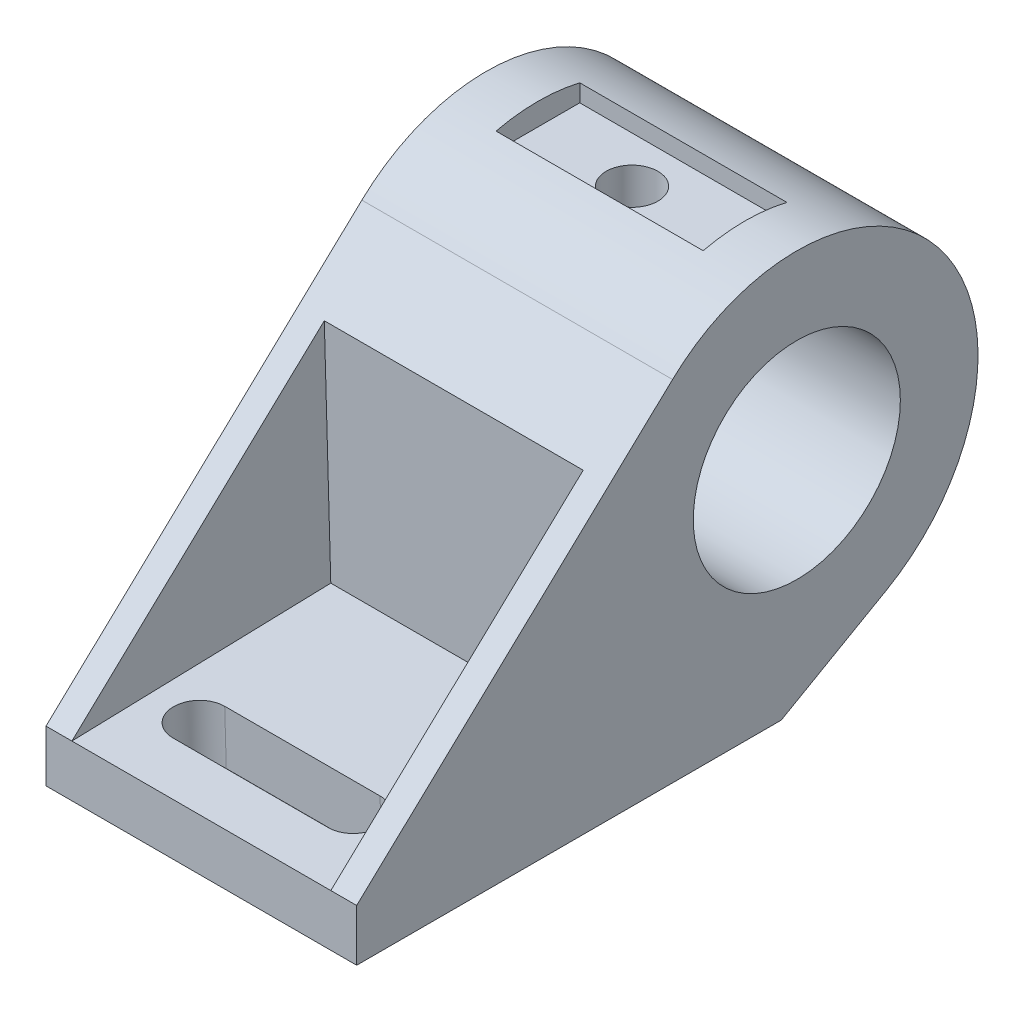
from build123d import *

# Parameters (mm, degrees)
SKETCH2_R           = 20
BOSS_EXTRUDE1_DEPTH = 60
CUT_EXTRUDE2_DEPTH  = 50
CUT_EXTRUDE3_DEPTH  = 50
SKETCH12_W          = 16.164310213
SKETCH12_H          = 9.181328202
CUT_EXTRUDE5_DEPTH  = 40
SKETCH13_R          = 5
CUT_EXTRUDE6_DEPTH  = 40


with BuildPart() as part:
    # Sketch2 → Boss-Extrude1 (new body)
    with BuildSketch(Plane(origin=(0, 0, 0), x_dir=(0, 0, -1), z_dir=(1, 0, 0))):
        with BuildLine():
            Line((-79.56687109, 0), (-79.56687109, 10))
            Line((-79.56687109, 10), (-18.568740921, 67.473716741))
            ThreePointArc((-18.568740921, 67.473716741), (33.570555999, 62.815503761), (22.769179524, 11.595044004))
            Line((22.769179524, 11.595044004), (2.43312891, 0))
            Line((2.43312891, 0), (-79.56687109, 0))
        make_face()
        with Locations((5.43312891, 42)):
            Circle(SKETCH2_R, mode=Mode.SUBTRACT)
    extrude(amount=-BOSS_EXTRUDE1_DEPTH)


with BuildPart() as part_1:
    # Body-Move/Copy1: moved
    add(part.part.moved(Location((5, 0, 0))))

    # Sketch4 → Cut-Extrude2 (cut)
    with BuildSketch(Plane(origin=(0, 0, 0), x_dir=(0, 0, -1), z_dir=(1, 0, 0))):
        Polygon((-79.56687109, 10), (-29.56687109, 11.408616082), (-30.821121194, 55.929267243), align=None)
    extrude(amount=-CUT_EXTRUDE2_DEPTH, mode=Mode.SUBTRACT)

    # Sketch5 → Cut-Extrude3 (cut)
    with BuildSketch(Plane(origin=(0, 12.231875294, 0.344600325), x_dir=(1, 0, 0), z_dir=(0, 0.9996033962131115, 0.028161148400119476))):
        with BuildLine():
            Line((-40.497825503, -59.233865026), (-10.497825503, -59.233865026))
            ThreePointArc((-10.497825503, -59.233865026), (-5.487906474, -64.243784055), (-10.497825503, -69.253703083))
            Line((-10.497825503, -69.253703083), (-40.497825503, -69.253703083))
            ThreePointArc((-40.497825503, -69.253703083), (-45.507744532, -64.243784055), (-40.497825503, -59.233865026))
        make_face()
    extrude(amount=-CUT_EXTRUDE3_DEPTH, mode=Mode.SUBTRACT)


with BuildPart() as part_2:
    # Body-Move/Copy2: moved
    add(part_1.part.moved(Location((5, 0, 0))))

    # Sketch12 → Cut-Extrude5 (cut)
    with BuildSketch(Plane(origin=(0, 0, 0), x_dir=(0, 0, -1), z_dir=(1, 0, 0))):
        with Locations((5.433128911, 77.294344512)):
            Rectangle(SKETCH12_W, SKETCH12_H)
    extrude(amount=-CUT_EXTRUDE5_DEPTH, mode=Mode.SUBTRACT)

    # Sketch13 → Cut-Extrude6 (cut)
    with BuildSketch(Plane(origin=(0, 72.703680411, 0), x_dir=(1, 0, 0), z_dir=(0, 1, 0))):
        with Locations(Location((-21.004088917, 4.614936989, 0), (0, 0, 270))):
            Circle(SKETCH13_R)
    extrude(amount=-CUT_EXTRUDE6_DEPTH, mode=Mode.SUBTRACT)


solid = part_2.part
